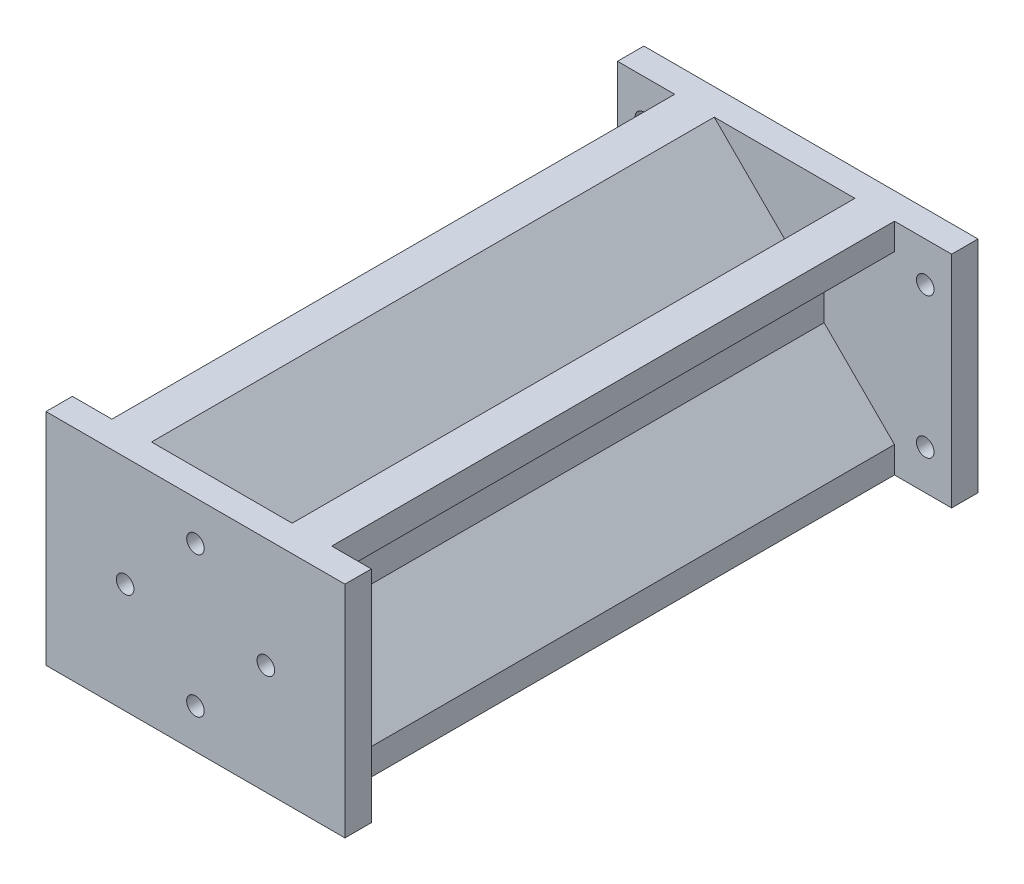
from build123d import *

# Parameters (mm, degrees)
SKETCH_1_W                       = 25
SKETCH_1_H                       = 25
EXTRUDE_1_DEPTH                  = 64
CUT_EXTRUDE_1_DEPTH              = 100
CUT_EXTRUDE_4_DEPTH              = 64
SKETCH_3_W                       = 38
SKETCH_3_H                       = 25
EXTRUDE_2_DEPTH                  = 3
SKETCH_4_R                       = 1
CUT_EXTRUDE_2_DEPTH              = 3
PATTERN_LINEAR_1_COUNT           = 2
PATTERN_LINEAR_1_PITCH           = 32
PATTERN_LINEAR_2_COUNT           = 2
PATTERN_LINEAR_2_PITCH           = 16
PATTERN_LINEAR_2_COPY_1_SKETCH_R = 1
PATTERN_LINEAR_2_COPY_1_DEPTH    = 3
SKETCH_6_W                       = 9.9
SKETCH_6_H                       = 5.8
EXTRUDE_3_DEPTH                  = 3
SKETCH_7_W                       = 34
SKETCH_7_H                       = 25
EXTRUDE_4_DEPTH                  = 3
SKETCH_8_R                       = 1
CUT_EXTRUDE_3_DEPTH              = 3
PATTERN_CIRCULAR_1_COUNT         = 4


with BuildPart() as part:
    # 草图1 → 凸台-拉伸1 (new body)
    with BuildSketch(Plane.XY):
        Rectangle(SKETCH_1_W, SKETCH_1_H)
    extrude(amount=EXTRUDE_1_DEPTH)

    # 草图2 → 切除-拉伸1 (cut)
    with BuildSketch(Plane(origin=(0, 0, 0), x_dir=(-1, 0, 0), z_dir=(0, 0, -1))):
        Polygon((-4.5, 1.5), (-12.5, 9.5), (-12.5, -9.5), (-4.5, -1.5), align=None)
    cut_extrude_1 = extrude(amount=-CUT_EXTRUDE_1_DEPTH, mode=Mode.SUBTRACT)

    # 镜向1: 切除-拉伸1 across plane
    add(cut_extrude_1.mirror(Plane(origin=(0, 0, 0), x_dir=(0, 0, 1), z_dir=(1, 0, 0))), mode=Mode.SUBTRACT)

    # 草图9 → 切除-拉伸4 (cut)
    with BuildSketch(Plane(origin=(0, 0, 0), x_dir=(-1, 0, 0), z_dir=(0, 0, -1))):
        Polygon((-8, 12.5), (0, 4.5), (8, 12.5), align=None)
    cut_extrude_4 = extrude(amount=-CUT_EXTRUDE_4_DEPTH, mode=Mode.SUBTRACT)

    # 镜向2: 切除-拉伸4 across plane
    add(cut_extrude_4.mirror(Plane.ZX), mode=Mode.SUBTRACT)

    # 草图3 → 凸台-拉伸2 (add)
    with BuildSketch(Plane(origin=(0, 0, 0), x_dir=(-1, 0, 0), z_dir=(0, 0, -1))):
        Rectangle(SKETCH_3_W, SKETCH_3_H)
    extrude(amount=EXTRUDE_2_DEPTH)

    # 草图4 → 切除-拉伸2 (cut)
    with BuildSketch(Plane(origin=(0, 0, -3), x_dir=(-1, 0, 0), z_dir=(0, 0, -1))):
        with Locations((-16, 8)):
            Circle(SKETCH_4_R)
    cut_extrude_2 = extrude(amount=-CUT_EXTRUDE_2_DEPTH, mode=Mode.SUBTRACT)

    # 阵列(线性)1: 切除-拉伸2 ×2
    with Locations(*[(-i * PATTERN_LINEAR_1_PITCH, 0, 0) for i in range(1, PATTERN_LINEAR_1_COUNT)]):
        add(cut_extrude_2, mode=Mode.SUBTRACT)

    # 阵列(线性)2: 切除-拉伸2 ×2
    with Locations(*[(0, -i * PATTERN_LINEAR_2_PITCH, 0) for i in range(1, PATTERN_LINEAR_2_COUNT)]):
        add(cut_extrude_2, mode=Mode.SUBTRACT)

    # 阵列(线性)2 copy 1 sketch → 阵列(线性)2 copy 1 (cut)
    with BuildSketch(Plane(origin=(-32, -16, -3), x_dir=(-1, 0, 0), z_dir=(0, 0, -1))):
        with Locations((-16, 8)):
            Circle(PATTERN_LINEAR_2_COPY_1_SKETCH_R)
    extrude(amount=-PATTERN_LINEAR_2_COPY_1_DEPTH, mode=Mode.SUBTRACT)

    # 草图6 → 凸台-拉伸3 (add)
    with BuildSketch(Plane(origin=(0, 0, -3), x_dir=(-1, 0, 0), z_dir=(0, 0, -1))):
        Rectangle(SKETCH_6_W, SKETCH_6_H)
    extrude(amount=EXTRUDE_3_DEPTH)

    # 草图7 → 凸台-拉伸4 (add)
    with BuildSketch(Plane.XY.offset(64)):
        Rectangle(SKETCH_7_W, SKETCH_7_H)
    extrude(amount=EXTRUDE_4_DEPTH)

    # 草图8 → 切除-拉伸3 (cut)
    with BuildSketch(Plane.XY.offset(67)):
        with Locations((0, 8)):
            Circle(SKETCH_8_R)
    cut_extrude_3 = extrude(amount=-CUT_EXTRUDE_3_DEPTH, mode=Mode.SUBTRACT)

    # 阵列(圆周)1: 切除-拉伸3 ×4 about axis
    pattern_circular_1_axis = Axis((0, 0, 0), (0, 0, 1))
    for i in range(1, PATTERN_CIRCULAR_1_COUNT):
        add(cut_extrude_3.rotate(pattern_circular_1_axis, i * 360 / PATTERN_CIRCULAR_1_COUNT), mode=Mode.SUBTRACT)


solid = part.part
